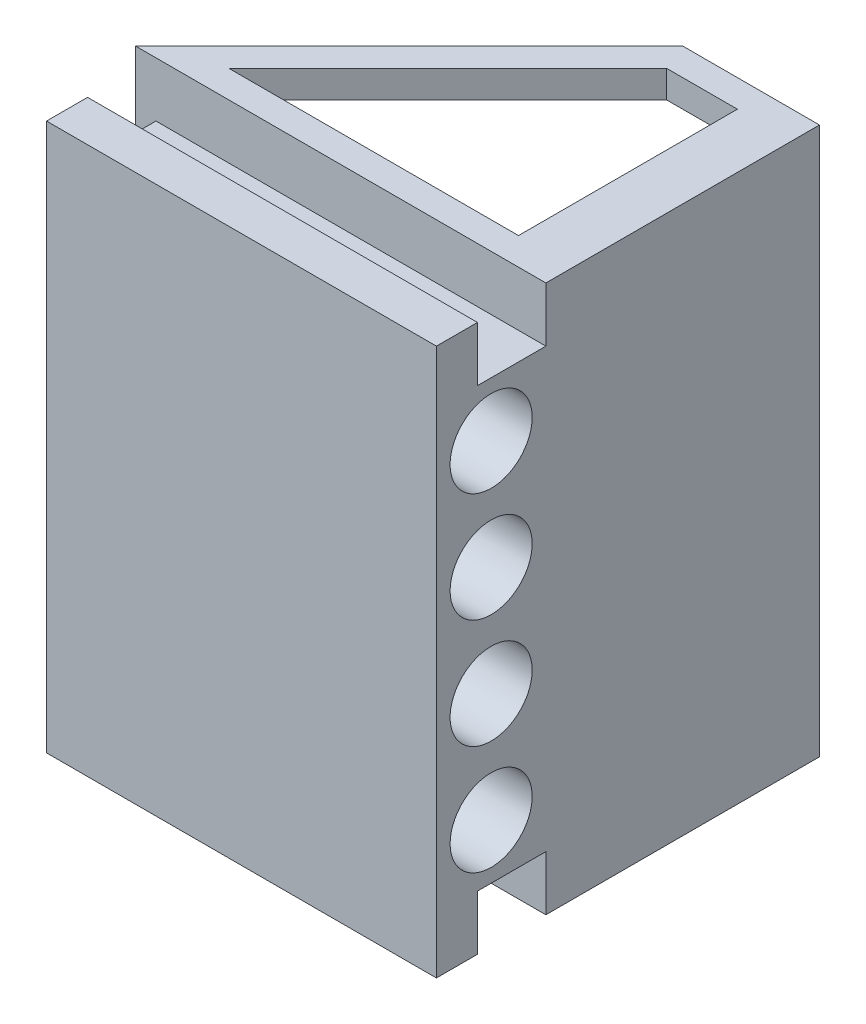
from build123d import *

# Parameters (mm, degrees)
SKETCH1_W           = 20
SKETCH1_H           = 40
BOSS_EXTRUDE1_DEPTH = 80
SKETCH8_W           = 16
SKETCH8_H           = 64
BOSS_EXTRUDE2_DEPTH = 57
SKETCH10_R          = 6
CUT_EXTRUDE1_DEPTH  = 51
CUT_EXTRUDE2_DEPTH  = 105.703357948
SKETCH12_W          = 57
SKETCH12_H          = 6
BOSS_EXTRUDE3_DEPTH = 8
SKETCH14_W          = 57
SKETCH14_H          = 6
BOSS_EXTRUDE4_DEPTH = 8
SKETCH17_W          = 48
SKETCH17_H          = 72
CUT_EXTRUDE4_DEPTH  = 36


with BuildPart() as part:
    # Sketch1 → Boss-Extrude1 (new body)
    with BuildSketch(Plane(origin=(0, 0, 0), x_dir=(1, 0, 0), z_dir=(0, 1, 0))):
        Polygon((-17.351649908, 20.312727502), (-57.351649908, -19.687272498), (-17.351649908, -19.687272498), align=None)
        with Locations((-7.351649908, 0.312727502)):
            Rectangle(SKETCH1_W, SKETCH1_H)
    extrude(amount=-BOSS_EXTRUDE1_DEPTH)

    # Sketch8 → Boss-Extrude2 (add)
    with BuildSketch(Plane(origin=(2.648350092, 0, 0), x_dir=(0, 0, -1), z_dir=(1, 0, 0))):
        with Locations((-27.687272498, -40)):
            Rectangle(SKETCH8_W, SKETCH8_H)
    extrude(amount=-BOSS_EXTRUDE2_DEPTH)

    # Sketch10 → Cut-Extrude1 (cut)
    with BuildSketch(Plane(origin=(2.648350092, 0, 0), x_dir=(0, 0, -1), z_dir=(1, 0, 0))):
        with Locations((-27.687272498, -16)):
            Circle(SKETCH10_R)
        with Locations(Location((-27.687272498, -32, 0), (0, 0, 180))):
            Circle(SKETCH10_R)
        with Locations(Location((-27.687272498, -64, 0), (0, 0, 180))):
            Circle(SKETCH10_R)
        with Locations((-27.687272498, -48)):
            Circle(SKETCH10_R)
    extrude(amount=-CUT_EXTRUDE1_DEPTH, mode=Mode.SUBTRACT)

    # Sketch11 → Cut-Extrude2 (cut, through all)
    with BuildSketch(Plane(origin=(0, 0, 0), x_dir=(1, 0, 0), z_dir=(0, 1, 0))):
        Polygon((-47.694795658, -15.687272498), (-15.694795658, 16.312727502), (-5.351649908, 16.312727502), (-5.351649908, -15.687272498), align=None)
    extrude(amount=-CUT_EXTRUDE2_DEPTH, mode=Mode.SUBTRACT)

    # Sketch12 → Boss-Extrude3 (add)
    with BuildSketch(Plane.XZ.offset(72)):
        with Locations((-25.851649908, 32.687272498)):
            Rectangle(SKETCH12_W, SKETCH12_H)
    extrude(amount=BOSS_EXTRUDE3_DEPTH)

    # Sketch14 → Boss-Extrude4 (add)
    with BuildSketch(Plane(origin=(0, -8, 0), x_dir=(1, 0, 0), z_dir=(0, 1, 0))):
        with Locations((-25.851649908, -32.687272498)):
            Rectangle(SKETCH14_W, SKETCH14_H)
    extrude(amount=BOSS_EXTRUDE4_DEPTH)

    # Sketch17 → Cut-Extrude4 (cut)
    with BuildSketch(Plane(origin=(0, 0, -20.312727502), x_dir=(-1, 0, 0), z_dir=(0, 0, -1))):
        with Locations((29.351649908, -40)):
            Rectangle(SKETCH17_W, SKETCH17_H)
    extrude(amount=-CUT_EXTRUDE4_DEPTH, mode=Mode.SUBTRACT)


solid = part.part
